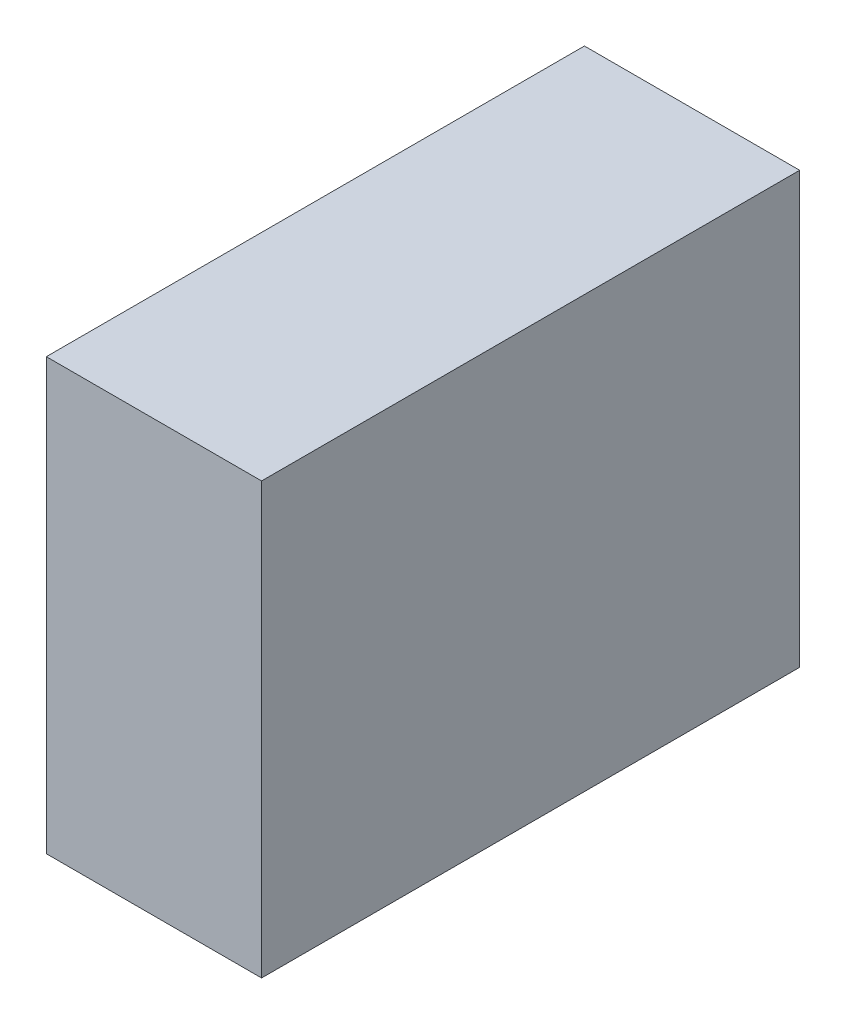
from build123d import *

# Parameters (mm, degrees)
SKETCH1_W           = 4
SKETCH1_H           = 8
BOSS_EXTRUDE1_DEPTH = 10


with BuildPart() as part:
    # Sketch1 → Boss-Extrude1 (new body)
    with BuildSketch(Plane.XY):
        Rectangle(SKETCH1_W, SKETCH1_H)
    extrude(amount=BOSS_EXTRUDE1_DEPTH)


solid = part.part
